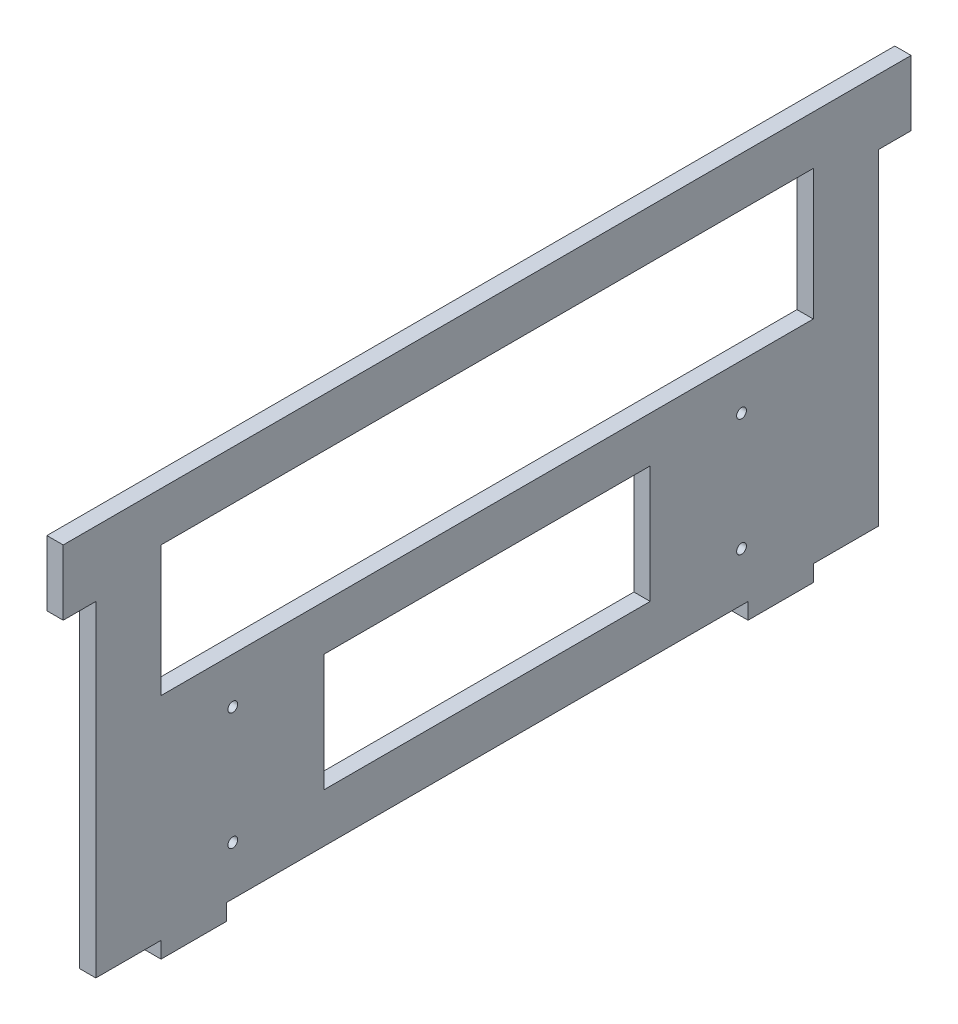
from build123d import *

# Parameters (mm, degrees)
SKIZZE2_W                       = 240
SKIZZE2_H                       = 120
SKIZZE2_W_2                     = 10
SKIZZE2_H_2                     = 20
SKIZZE2_W_3                     = 20
SKIZZE2_H_3                     = 5
AUFSATZ_LINEAR_AUSTRAGEN1_DEPTH = 5
SKIZZE3_R                       = 1.5
SKIZZE3_W                       = 100
SKIZZE3_H                       = 36
SKIZZE3_W_2                     = 200
SKIZZE3_H_2                     = 40
SCHNITT_LINEAR_AUSTRAGEN1_DEPTH = 146.430395722


with BuildPart() as part:
    # Skizze2 → Aufsatz-Linear austragen1 (new body)
    with BuildSketch(Plane(origin=(0, 0, 0), x_dir=(0, 0, -1), z_dir=(1, 0, 0))):
        Rectangle(SKIZZE2_W, SKIZZE2_H)
        with Locations((-125, 50)):
            Rectangle(SKIZZE2_W_2, SKIZZE2_H_2)
        with Locations((125, 50)):
            Rectangle(SKIZZE2_W_2, SKIZZE2_H_2)
        with Locations((-90, -62.5)):
            Rectangle(SKIZZE2_W_3, SKIZZE2_H_3)
        with Locations((90, -62.5)):
            Rectangle(SKIZZE2_W_3, SKIZZE2_H_3)
    extrude(amount=AUFSATZ_LINEAR_AUSTRAGEN1_DEPTH)

    # Skizze3 → Schnitt-Linear austragen1 (cut, through all)
    with BuildSketch(Plane.ZY):
        with Locations((-78, -9)):
            Circle(SKIZZE3_R)
        with Locations((78, -45)):
            Circle(SKIZZE3_R)
        with Locations((-78, -45)):
            Circle(SKIZZE3_R)
        with Locations((78, -9)):
            Circle(SKIZZE3_R)
        with Locations((0, -27)):
            Rectangle(SKIZZE3_W, SKIZZE3_H)
        with Locations((0, 25)):
            Rectangle(SKIZZE3_W_2, SKIZZE3_H_2)
    extrude(amount=-SCHNITT_LINEAR_AUSTRAGEN1_DEPTH, mode=Mode.SUBTRACT)


solid = part.part
